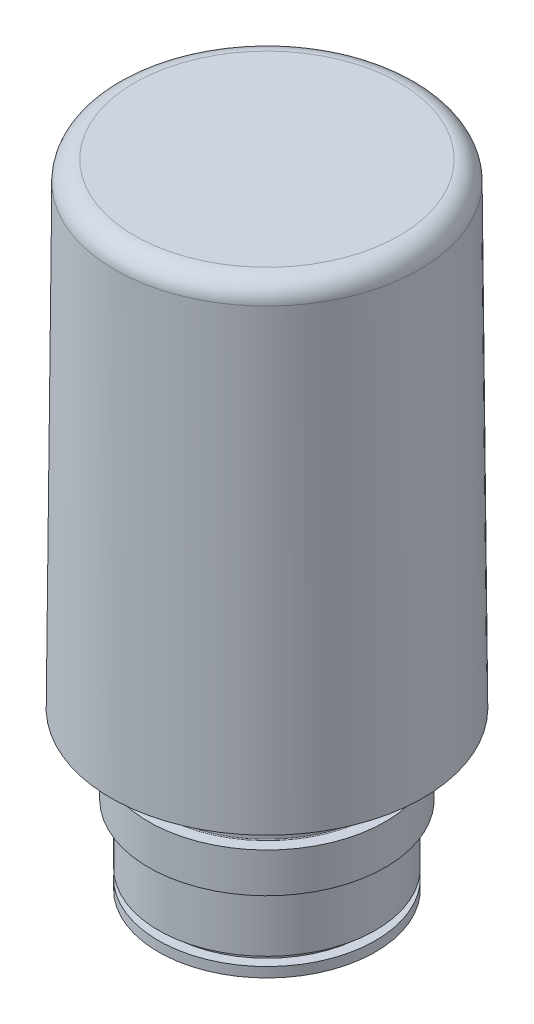
from build123d import *

# Parameters (mm, degrees)
FILLET2_R        = 3.175
FILLET4_R        = 0.127
HC843E_FILLET3_R = 3.175


with BuildPart() as part:
    # Sketch1 → Revolve1 (revolve)
    with BuildSketch(Plane.XY):
        Polygon((-13.97, 0), (-17.399, 0), (-17.399, 1.5875), (-15.7607, 1.5875), (-15.7607, 3.0099), (-17.399, 3.0099), (-17.399, 12.5349), (-18.9738, 12.5349), (-18.9738, 18.8849), (-17.018, 18.8849), (-17.018, 22.4409), (-18.9738, 22.4409), (-18.9738, 25.2349), (-18.308812674, 101.4349), (0, 101.4349), (0, 96.3549), (-12.7, 96.3549), (-13.009873622, 60.8469), (-13.97, 60.8469), (-13.97, 60.0269), (-14.7, 60.0269), (-14.7, 58.7269026), (-13.97, 58.7269026), (-13.97, 37.9349), (-14.7, 37.9349), (-14.7, 36.6349026), (-13.97, 36.6349026), align=None)
    revolve(axis=Axis((0, 0, 0), (0, 1, 0)))

    # Fillet2
    fillet2_edges = [part.edges().sort_by_distance(p)[0] for p in [
        (12.7, 96.3549, 0),
    ]]
    fillet(fillet2_edges, radius=FILLET2_R)

    # Fillet4
    fillet4_edges = [part.edges().sort_by_distance(p)[0] for p in [
        (17.018, 18.8849, 0),
        (17.018, 22.4409, 0),
    ]]
    fillet(fillet4_edges, radius=FILLET4_R)

    # Sketch4 → HC843E Revolve3 (revolve)
    with BuildSketch(Plane.XY):
        Polygon((-18.308812674, 101.4349), (-24.387019881, 101.4349), (-25.052007206, 25.2349), (-18.9738, 25.2349), align=None)
    revolve(axis=Axis((0, 0, 0), (0, 1, 0)))

    # HC843E Fillet3
    hc843e_fillet3_edges = [part.edges().sort_by_distance(p)[0] for p in [
        (24.387019881, 101.4349, 0),
    ]]
    fillet(hc843e_fillet3_edges, radius=HC843E_FILLET3_R)


solid = part.part
